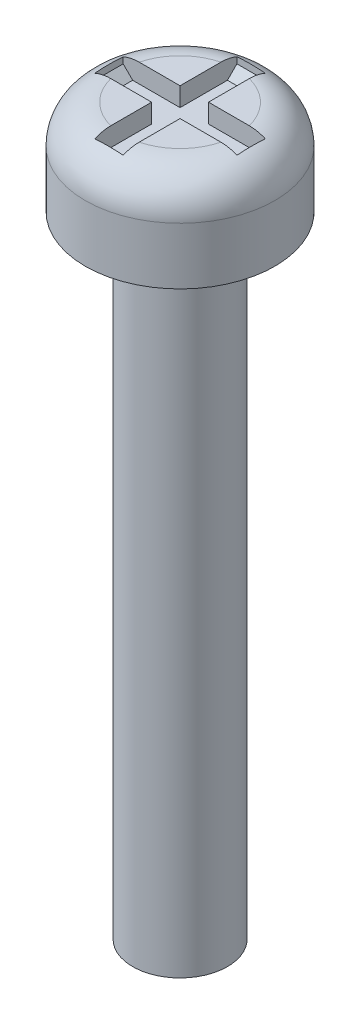
from build123d import *

# Parameters (mm, degrees)
SKETCH1_R           = 2
BOSS_EXTRUDE1_DEPTH = 2
FILLET1_R           = 0.8
SKETCH2_W           = 0.6
SKETCH2_H           = 0.6
CUT_EXTRUDE1_DEPTH  = 0.4
CHAMFER1_SIZE       = 0.2
SKETCH3_R           = 1
BOSS_EXTRUDE2_DEPTH = 13.3


with BuildPart() as part:
    # Sketch1 → Boss-Extrude1 (new body)
    with BuildSketch(Plane(origin=(0, 0, 0), x_dir=(1, 0, 0), z_dir=(0, 1, 0))):
        with Locations(Location((0, 0, 0), (0, 0, 270))):
            Circle(SKETCH1_R)
    extrude(amount=BOSS_EXTRUDE1_DEPTH)

    # Fillet1
    fillet1_edges = [part.edges().sort_by_distance(p)[0] for p in [
        (0, 2, -2),
    ]]
    fillet(fillet1_edges, radius=FILLET1_R)

    # Sketch2 → Cut-Extrude1 (cut)
    with BuildSketch(Plane(origin=(0, 2, 0), x_dir=(1, 0, 0), z_dir=(0, 1, 0))):
        with BuildLine():
            Line((-0.3, 0.3), (-1.161895004, 0.3))
            ThreePointArc((-1.161895004, 0.3), (-1.2, 0), (-1.161895004, -0.3))
            Line((-1.161895004, -0.3), (-0.3, -0.3))
            Line((-0.3, -0.3), (-0.3, 0.3))
        make_face()
        with BuildLine():
            Line((-0.3, 1.161895004), (-0.3, 0.3))
            Line((-0.3, 0.3), (0.3, 0.3))
            Line((0.3, 0.3), (0.3, 1.161895004))
            ThreePointArc((0.3, 1.161895004), (0, 1.2), (-0.3, 1.161895004))
        make_face()
        with BuildLine():
            Line((-1.161895004, 0.3), (-1.5, 0.3))
            Line((-1.5, 0.3), (-1.5, -0.3))
            Line((-1.5, -0.3), (-1.161895004, -0.3))
            ThreePointArc((-1.161895004, -0.3), (-1.2, 0), (-1.161895004, 0.3))
        make_face()
        with BuildLine():
            Line((-0.3, 1.5), (-0.3, 1.161895004))
            ThreePointArc((-0.3, 1.161895004), (0, 1.2), (0.3, 1.161895004))
            Line((0.3, 1.161895004), (0.3, 1.5))
            Line((0.3, 1.5), (-0.3, 1.5))
        make_face()
        with BuildLine():
            Line((1.161895004, 0.3), (0.3, 0.3))
            Line((0.3, 0.3), (0.3, -0.3))
            Line((0.3, -0.3), (1.161895004, -0.3))
            ThreePointArc((1.161895004, -0.3), (1.190435636, -0.151205151), (1.2, 0))
            ThreePointArc((1.2, 0), (1.190435636, 0.151205151), (1.161895004, 0.3))
        make_face()
        with BuildLine():
            Line((1.5, 0.3), (1.161895004, 0.3))
            ThreePointArc((1.161895004, 0.3), (1.190435636, 0.151205151), (1.2, 0))
            ThreePointArc((1.2, 0), (1.190435636, -0.151205151), (1.161895004, -0.3))
            Line((1.161895004, -0.3), (1.5, -0.3))
            Line((1.5, -0.3), (1.5, 0.3))
        make_face()
        Rectangle(SKETCH2_W, SKETCH2_H)
        with BuildLine():
            Line((0.3, -0.3), (-0.3, -0.3))
            Line((-0.3, -0.3), (-0.3, -1.161895004))
            ThreePointArc((-0.3, -1.161895004), (0, -1.2), (0.3, -1.161895004))
            Line((0.3, -1.161895004), (0.3, -0.3))
        make_face()
        with BuildLine():
            ThreePointArc((0.3, -1.161895004), (0, -1.2), (-0.3, -1.161895004))
            Line((-0.3, -1.161895004), (-0.3, -1.5))
            Line((-0.3, -1.5), (0.3, -1.5))
            Line((0.3, -1.5), (0.3, -1.161895004))
        make_face()
    extrude(amount=-CUT_EXTRUDE1_DEPTH, mode=Mode.SUBTRACT)

    # Chamfer1
    chamfer1_edges = [part.edges().sort_by_distance(p)[0] for p in [
        (-1.5, 1.6, 0),
        (0, 1.6, 1.5),
        (0, 1.6, -1.5),
        (1.5, 1.6, 0),
    ]]
    chamfer(chamfer1_edges, length=CHAMFER1_SIZE)

    # Sketch3 → Boss-Extrude2 (add)
    with BuildSketch(Plane.XZ):
        with Locations(Location((0, 0, 0), (0, 0, 270))):
            Circle(SKETCH3_R)
    extrude(amount=BOSS_EXTRUDE2_DEPTH)


solid = part.part
